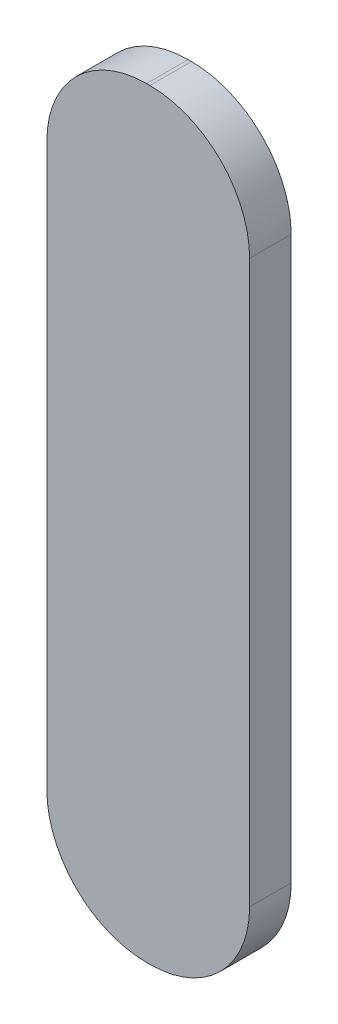
from build123d import *

# Parameters (mm, degrees)
SKETCH1_W           = 12.2
SKETCH1_H           = 45.8
BOSS_EXTRUDE1_DEPTH = 2.5
FILLET1_R           = 6


with BuildPart() as part:
    # Sketch1 → Boss-Extrude1 (new body)
    with BuildSketch(Plane.XY.offset(10)):
        with Locations((-182.131179691, 159.988166791)):
            Rectangle(SKETCH1_W, SKETCH1_H)
    extrude(amount=BOSS_EXTRUDE1_DEPTH)

    # Fillet1
    fillet1_edges = [part.edges().sort_by_distance(p)[0] for p in [
        (-188.231179691, 182.888166791, 11.25),
        (-176.031179691, 182.888166791, 11.25),
        (-176.031179691, 137.088166791, 11.25),
        (-188.231179691, 137.088166791, 11.25),
    ]]
    fillet(fillet1_edges, radius=FILLET1_R)


solid = part.part
